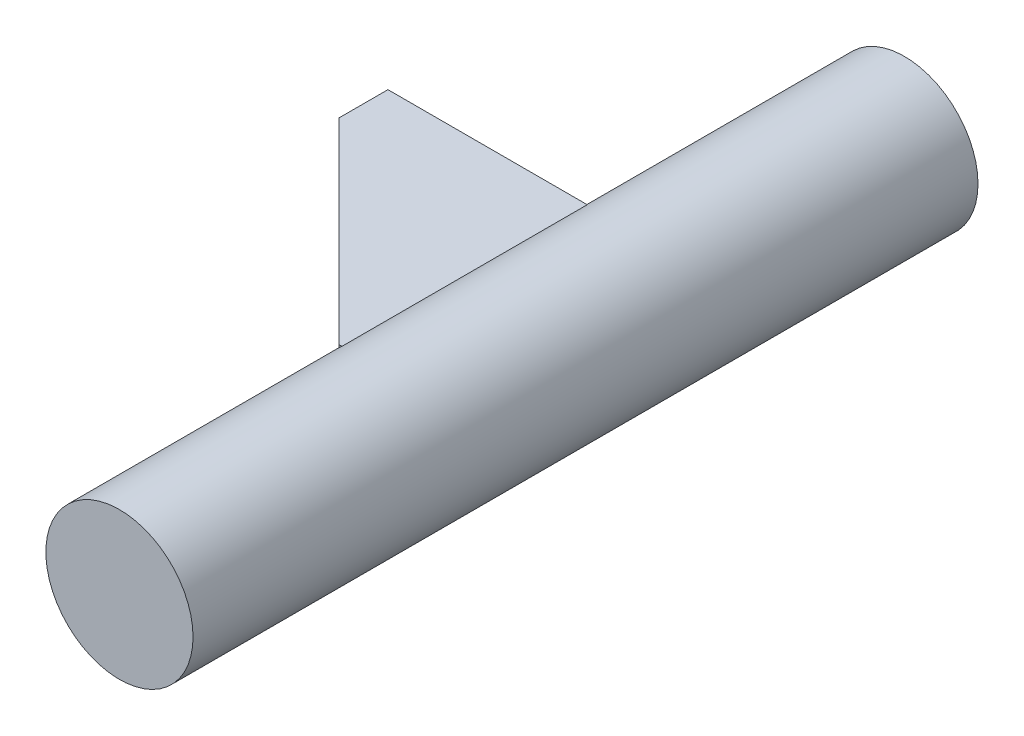
from build123d import *

# Parameters (mm, degrees)
SKETCH_1_R      = 3
EXTRUDE_1_DEPTH = 16
SKETCH_2_W      = 10.054460063
SKETCH_2_H      = 4.37386331
EXTRUDE_2_DEPTH = 5
CHAMFER_1_SIZE  = 8


with BuildPart() as part:
    # 스케치1 → 보스-돌출1 (new, symmetric)
    with BuildSketch(Plane.XY):
        Circle(SKETCH_1_R)
    extrude(amount=EXTRUDE_1_DEPTH, both=True)

    # 스케치2 → 보스-돌출2 (add, symmetric)
    with BuildSketch(Plane.XY):
        with Locations((-5.027230032, 0.110464554)):
            Rectangle(SKETCH_2_W, SKETCH_2_H)
    extrude(amount=EXTRUDE_2_DEPTH, both=True)

    # 모따기1
    chamfer_1_edges = [part.edges().sort_by_distance(p)[0] for p in [
        (-10.054460063, 0.110464554, 5),
    ]]
    chamfer(chamfer_1_edges, length=CHAMFER_1_SIZE)


solid = part.part
